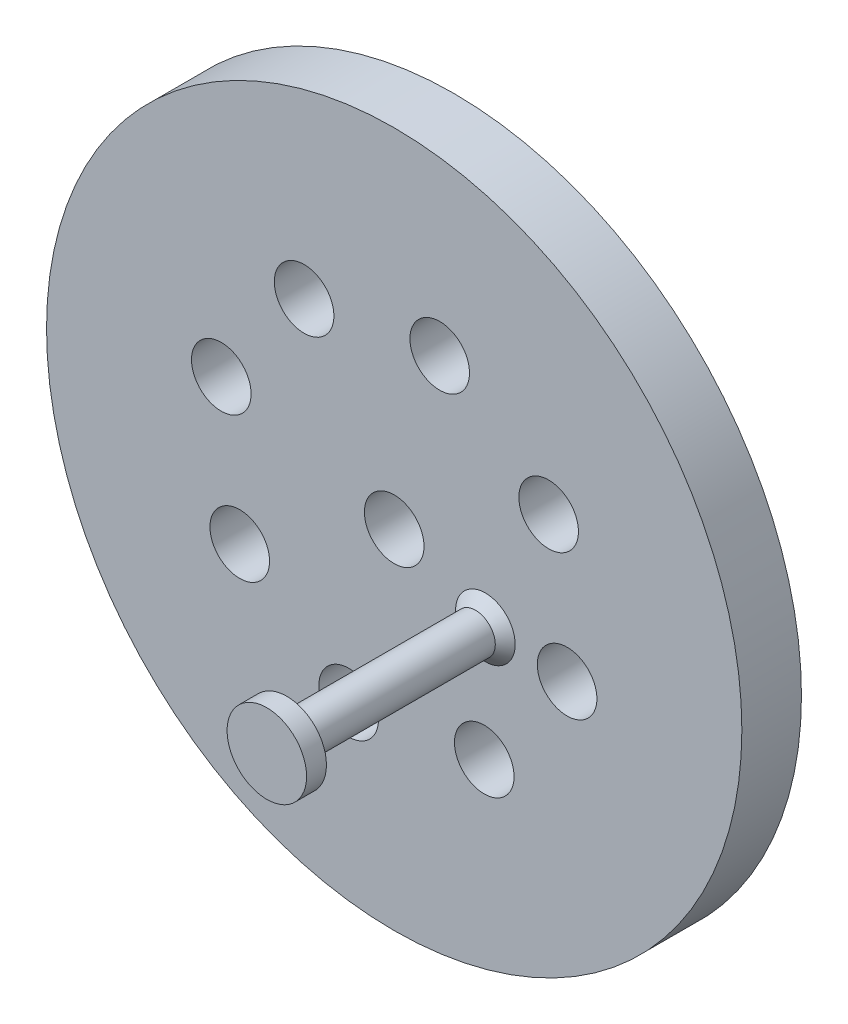
from build123d import *

# Parameters (mm, degrees)
SKETCH_1_R          = 35
SKETCH_1_R_2        = 3
EXTRUDE_1_DEPTH     = 6
SKETCH_3_R          = 3
CUT_EXTRUDE_2_DEPTH = 50.859803449
SKETCH_4_R          = 2
EXTRUDE_2_DEPTH     = 22
SKETCH_7_R          = 4
EXTRUDE_3_DEPTH     = 2
CHAMFER_1_SIZE      = 1


with BuildPart() as part:
    # 草图1 → 凸台-拉伸1 (new body)
    with BuildSketch(Plane.XY):
        Circle(SKETCH_1_R)
        Circle(SKETCH_1_R_2, mode=Mode.SUBTRACT)
    extrude(amount=EXTRUDE_1_DEPTH)

    # 草图3 → 切除-拉伸2 (cut, through all)
    with BuildSketch(Plane(origin=(0, 0, 0), x_dir=(-1, 0, 0), z_dir=(0, 0, -1))):
        with Locations((-4.582105158, 17.407019053)):
            Circle(SKETCH_3_R)
        with Locations((9.068583583, 15.548658842)):
            Circle(SKETCH_3_R)
        with Locations((17.407019053, 4.582105158)):
            Circle(SKETCH_3_R)
        with Locations((15.548658842, -9.068583583)):
            Circle(SKETCH_3_R)
        with Locations((4.582105158, -17.407019053)):
            Circle(SKETCH_3_R)
        with Locations((-9.068583583, -15.548658842)):
            Circle(SKETCH_3_R)
        with Locations((-17.407019053, -4.582105158)):
            Circle(SKETCH_3_R)
        with Locations((-15.548658842, 9.068583583)):
            Circle(SKETCH_3_R)
    extrude(amount=-CUT_EXTRUDE_2_DEPTH, mode=Mode.SUBTRACT)

    # 草图4 → 凸台-拉伸2 (add)
    with BuildSketch(Plane.XY.offset(6)):
        with Locations((9.178670771, -3.968879298)):
            Circle(SKETCH_4_R)
    extrude(amount=EXTRUDE_2_DEPTH)

    # 草图7 → 凸台-拉伸3 (add)
    with BuildSketch(Plane.XY.offset(28)):
        with Locations((9.178670771, -3.968879298)):
            Circle(SKETCH_7_R)
    extrude(amount=-EXTRUDE_3_DEPTH)

    # 倒角1
    chamfer_1_edges = [part.edges().sort_by_distance(p)[0] for p in [
        (7.178670771, -3.968879298, 6),
    ]]
    chamfer(chamfer_1_edges, length=CHAMFER_1_SIZE)


solid = part.part
